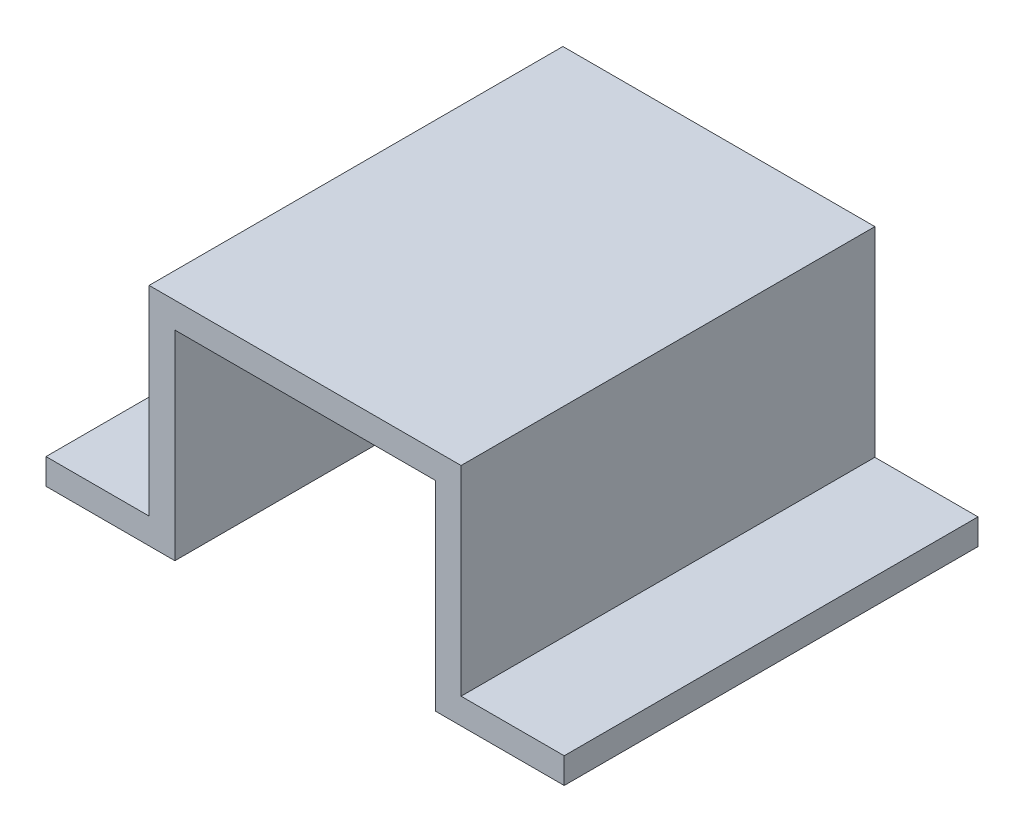
from build123d import *

# Parameters (mm, degrees)
BOSS_EXTRUDE1_DEPTH = 32.1


with BuildPart() as part:
    # Sketch1 → Boss-Extrude1 (new body)
    with BuildSketch(Plane.XY):
        Polygon((26.177011494, -18.66091954), (16.177011494, -18.66091954), (16.177011494, -3.16091954), (-4.022988506, -3.16091954), (-4.022988506, -18.66091954), (-14.022988506, -18.66091954), (-14.022988506, -16.66091954), (-6.022988506, -16.66091954), (-6.022988506, -1.16091954), (18.177011494, -1.16091954), (18.177011494, -16.66091954), (26.177011494, -16.66091954), align=None)
    extrude(amount=-BOSS_EXTRUDE1_DEPTH)


solid = part.part
